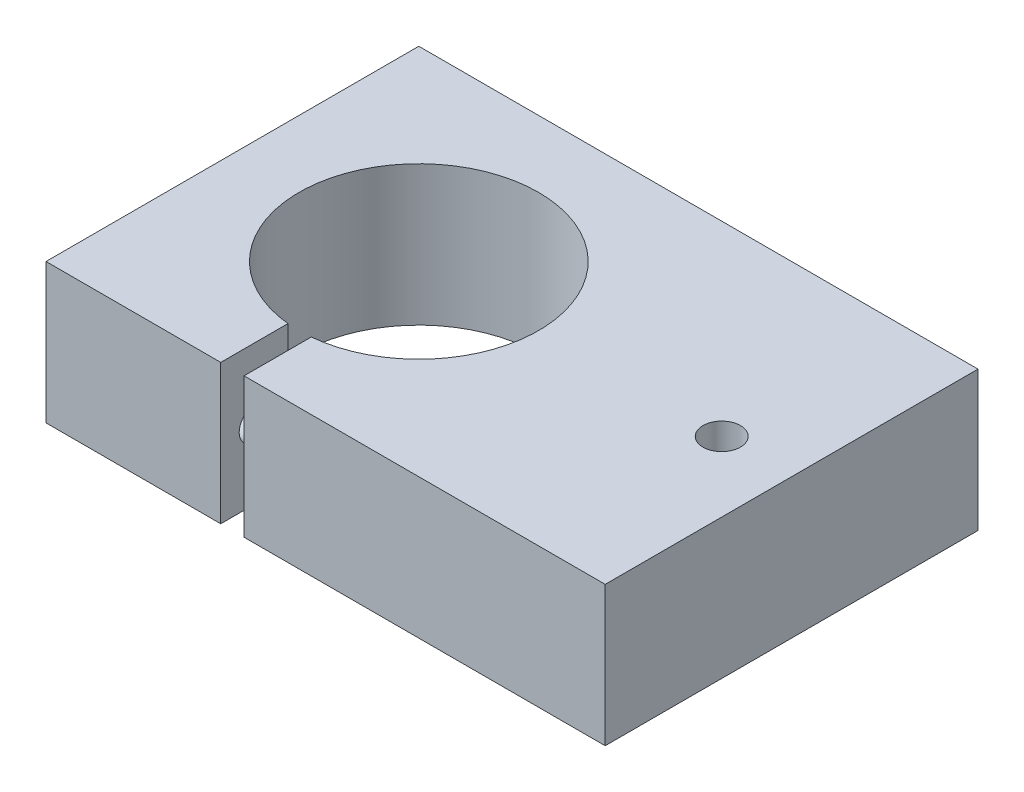
from build123d import *

# Parameters (mm, degrees)
SKETCH1_W                                      = 76.2
SKETCH1_H                                      = 50.8
BOSS_EXTRUDE1_DEPTH                            = 9.525
SKETCH2_R                                      = 16.3195
CUT_EXTRUDE1_DEPTH                             = 50.595085442
SKETCH3_W                                      = 3.175
SKETCH3_H                                      = 28.019395236
CUT_EXTRUDE2_DEPTH                             = 50.595085442
CBORE_FOR_8_SOCKET_HEAD_CAP_SCREW1_D           = 4.4958
CBORE_FOR_8_SOCKET_HEAD_CAP_SCREW1_DEPTH       = 23.8125
CBORE_FOR_8_SOCKET_HEAD_CAP_SCREW1_CBORE_D     = 7.9375
CBORE_FOR_8_SOCKET_HEAD_CAP_SCREW1_CBORE_DEPTH = 4.1656
F_8_32_TAPPED_HOLE1_D                          = 3.4544
F_8_32_TAPPED_HOLE1_DEPTH                      = 12.7
F_8_32_TAPPED_HOLE1_TIP                        = 1.037806461
F_1_4_20_TAPPED_HOLE1_D                        = 5.1054


with BuildPart() as part:
    # Sketch1 → Boss-Extrude1 (new, symmetric)
    with BuildSketch(Plane(origin=(0, 0, 0), x_dir=(1, 0, 0), z_dir=(0, 1, 0))):
        Rectangle(SKETCH1_W, SKETCH1_H)
    extrude(amount=BOSS_EXTRUDE1_DEPTH, both=True)

    # Sketch2 → Cut-Extrude1 (cut, through all)
    with BuildSketch(Plane(origin=(0, 9.525, 0), x_dir=(1, 0, 0), z_dir=(0, 1, 0))):
        with Locations(Location((-12.7, 0, 0), (0, 0, 270))):
            Circle(SKETCH2_R)
    extrude(amount=-CUT_EXTRUDE1_DEPTH, mode=Mode.SUBTRACT)

    # Sketch3 → Cut-Extrude2 (cut, through all)
    with BuildSketch(Plane(origin=(0, 9.525, 0), x_dir=(1, 0, 0), z_dir=(0, 1, 0))):
        with Locations((-12.7, -14.009697618)):
            Rectangle(SKETCH3_W, SKETCH3_H)
    extrude(amount=-CUT_EXTRUDE2_DEPTH, mode=Mode.SUBTRACT)

    # CBORE for #8 Socket Head Cap Screw1
    with Locations(Plane.ZY.offset(38.1)):
        with Locations((20.6375, 0)):
            CounterBoreHole(CBORE_FOR_8_SOCKET_HEAD_CAP_SCREW1_D / 2, CBORE_FOR_8_SOCKET_HEAD_CAP_SCREW1_CBORE_D / 2, CBORE_FOR_8_SOCKET_HEAD_CAP_SCREW1_CBORE_DEPTH, depth=CBORE_FOR_8_SOCKET_HEAD_CAP_SCREW1_DEPTH)

    # #8-32 Tapped Hole1
    with Locations(Plane.ZY.offset(11.1125)):
        with Locations((20.6375, 0)):
            Hole(F_8_32_TAPPED_HOLE1_D / 2, depth=F_8_32_TAPPED_HOLE1_DEPTH)
            with Locations((0, 0, -(F_8_32_TAPPED_HOLE1_DEPTH + F_8_32_TAPPED_HOLE1_TIP / 2))):  # 118° drill point
                Cone(0, F_8_32_TAPPED_HOLE1_D / 2, F_8_32_TAPPED_HOLE1_TIP, mode=Mode.SUBTRACT)

    # 1/4-20 Tapped Hole1 (through all)
    with Locations(Plane(origin=(0, 9.525, 0), x_dir=(1, 0, 0), z_dir=(0, 1, 0))):
        with Locations((28.575, 0)):
            Hole(F_1_4_20_TAPPED_HOLE1_D / 2)


solid = part.part
